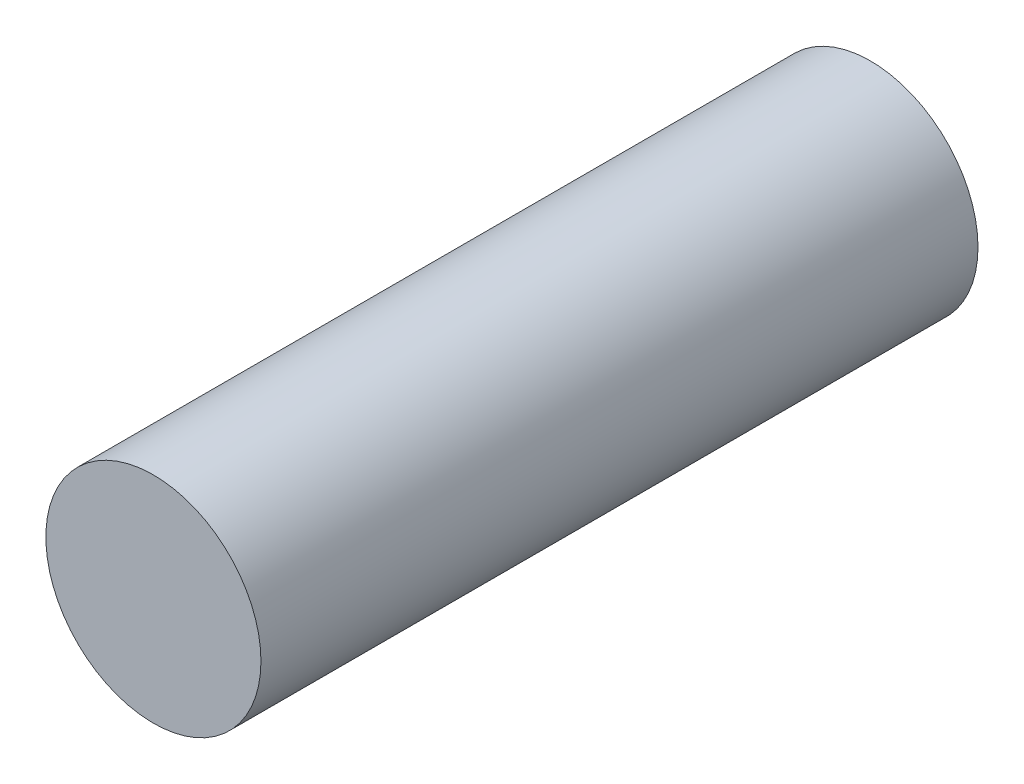
from build123d import *

# Parameters (mm, degrees)
SKETCH1_R           = 76.2
BOSS_EXTRUDE1_DEPTH = 508


with BuildPart() as part:
    # Sketch1 → Boss-Extrude1 (new body)
    with BuildSketch(Plane.XY):
        Circle(SKETCH1_R)
    extrude(amount=BOSS_EXTRUDE1_DEPTH)


solid = part.part
